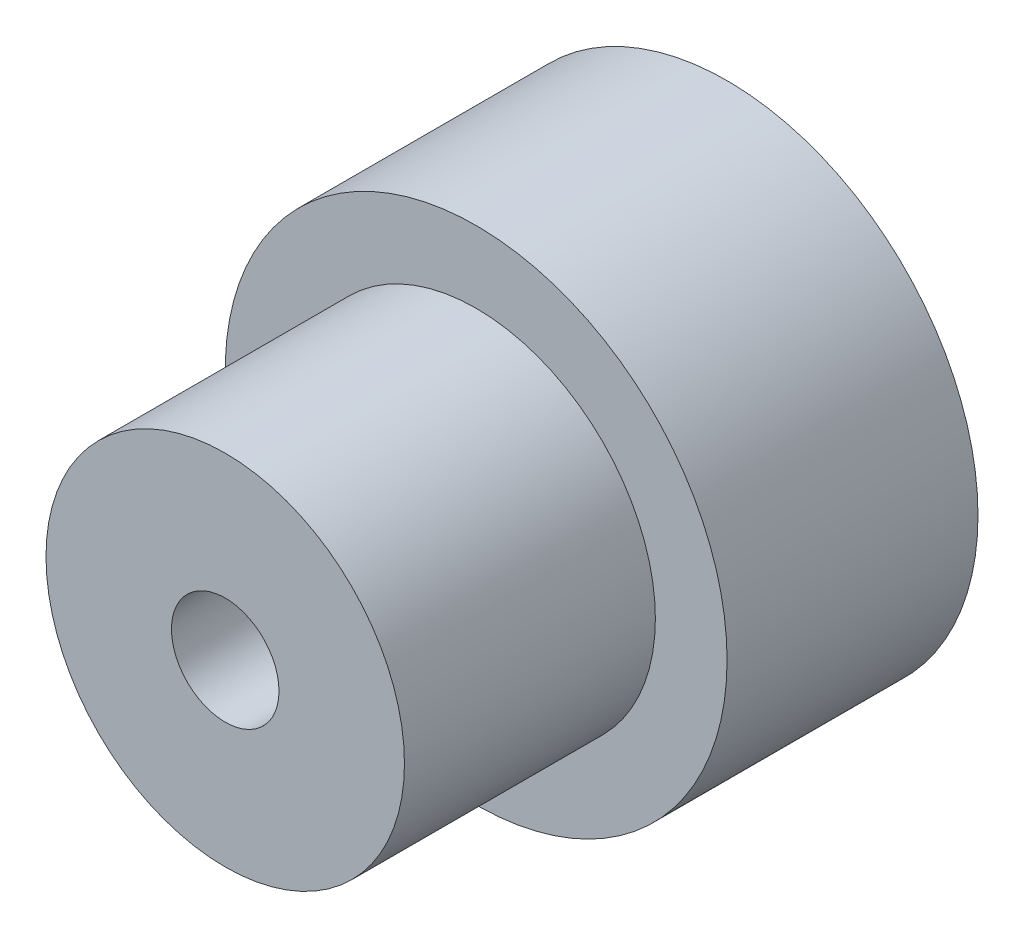
from build123d import *

# Parameters (mm, degrees)
SKETCH_1_R          = 7
EXTRUDE_1_DEPTH     = 7
SKETCH_2_R          = 5
EXTRUDE_2_DEPTH     = 7
SKETCH_3_R          = 1.5
CUT_EXTRUDE_1_DEPTH = 18.146428199


with BuildPart() as part:
    # 草图1 → 凸台-拉伸1 (new body)
    with BuildSketch(Plane.XY):
        Circle(SKETCH_1_R)
    extrude(amount=EXTRUDE_1_DEPTH)

    # 草图2 → 凸台-拉伸2 (add)
    with BuildSketch(Plane.XY.offset(7)):
        Circle(SKETCH_2_R)
    extrude(amount=EXTRUDE_2_DEPTH)

    # 草图3 → 切除-拉伸1 (cut, through all)
    with BuildSketch(Plane.XY.offset(14)):
        Circle(SKETCH_3_R)
    extrude(amount=-CUT_EXTRUDE_1_DEPTH, mode=Mode.SUBTRACT)


solid = part.part
